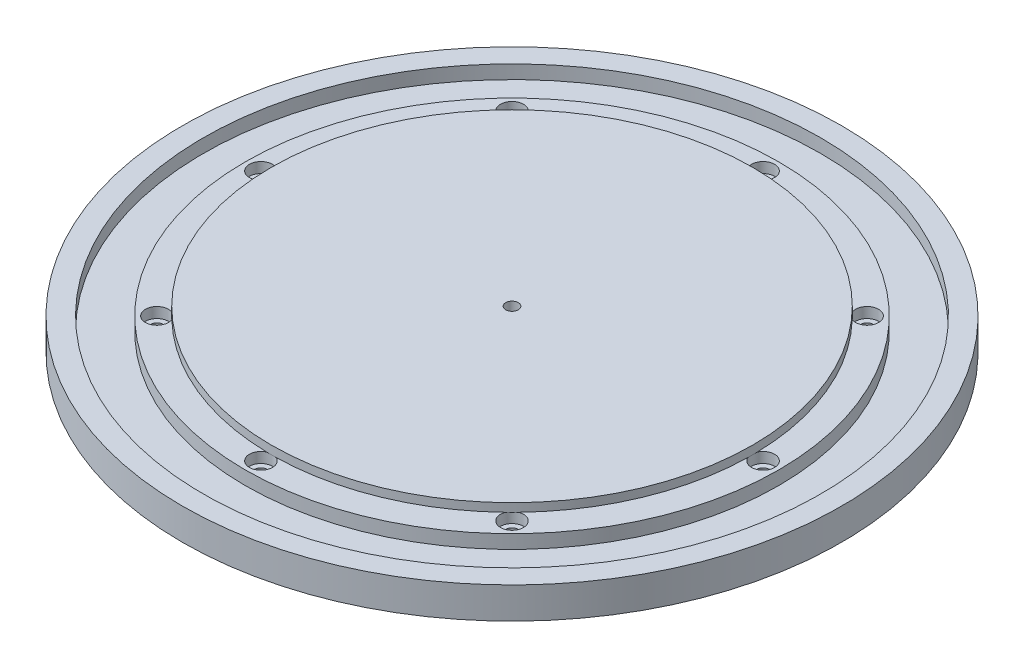
from build123d import *

# Parameters (mm, degrees)
SKETCH2_R               = 11
CUT_EXTRUDE1_DEPTH      = 10
SKETCH3_R               = 6
CUT_EXTRUDE2_DEPTH      = 447.486281987
CUT_EXTRUDE3_DEPTH      = 88
CUT_EXTRUDE3_DEPTH_BACK = 69
SKETCH4_R               = 6


with BuildPart() as part:
    # Sketch1 → Revolve1 (revolve)
    with BuildSketch(Plane(origin=(0, 0, 0), x_dir=(0, 0, -1), z_dir=(1, 0, 0)), mode=Mode.PRIVATE) as revolve1_sk:
        Polygon((-315.000000002, 14.605962764), (-315.000000002, 44.605962764), (-295.000000002, 44.605962764), (-295.000000002, 31.605962764), (-255.000000002, 31.605962764), (-255.000000002, 44.605962764), (-230, 44.605962764), (-230, 52.605962764), (0, 52.605962764), (0, 44.605962764), (0, 14.605962764), (-229.500000002, 14.605962764), align=None)
    revolve(revolve1_sk.sketch.rotate(Axis((0, -1000, 0), (0, 1, 0)), 180), axis=Axis((0, -1000, 0), (0, 1, 0)))

    # Sketch2 → Cut-Extrude1 (cut)
    with BuildSketch(Plane(origin=(0, 44.605962764, 0), x_dir=(1, 0, 0), z_dir=(0, 1, 0))):
        with Locations(Location((0, 240, 0), (0, 0, 270))):
            Circle(SKETCH2_R)
        with Locations(Location((169.705627485, 169.705627485, 0), (0, 0, 270))):
            Circle(SKETCH2_R)
        with Locations(Location((240, 0, 0), (0, 0, 270))):
            Circle(SKETCH2_R)
        with Locations(Location((169.705627485, -169.705627485, 0), (0, 0, 270))):
            Circle(SKETCH2_R)
        with Locations(Location((0, -240, 0), (0, 0, 270))):
            Circle(SKETCH2_R)
        with Locations(Location((-169.705627485, -169.705627485, 0), (0, 0, 270))):
            Circle(SKETCH2_R)
        with Locations(Location((-240, 0, 0), (0, 0, 270))):
            Circle(SKETCH2_R)
        with Locations(Location((-169.705627485, 169.705627485, 0), (0, 0, 270))):
            Circle(SKETCH2_R)
    extrude(amount=-CUT_EXTRUDE1_DEPTH, mode=Mode.SUBTRACT)

    # Sketch3 → Cut-Extrude2 (cut, through all)
    with BuildSketch(Plane(origin=(0, 44.605962764, 0), x_dir=(1, 0, 0), z_dir=(0, 1, 0))):
        with Locations(Location((0, 240, 0), (0, 0, 270))):
            Circle(SKETCH3_R)
        with Locations(Location((169.705627485, 169.705627485, 0), (0, 0, 270))):
            Circle(SKETCH3_R)
        with Locations(Location((240, 0, 0), (0, 0, 270))):
            Circle(SKETCH3_R)
        with Locations(Location((169.705627485, -169.705627485, 0), (0, 0, 270))):
            Circle(SKETCH3_R)
        with Locations(Location((0, -240, 0), (0, 0, 270))):
            Circle(SKETCH3_R)
        with Locations(Location((-169.705627485, -169.705627485, 0), (0, 0, 270))):
            Circle(SKETCH3_R)
        with Locations(Location((-240, 0, 0), (0, 0, 270))):
            Circle(SKETCH3_R)
        with Locations(Location((-169.705627485, 169.705627485, 0), (0, 0, 270))):
            Circle(SKETCH3_R)
    extrude(amount=-CUT_EXTRUDE2_DEPTH, mode=Mode.SUBTRACT)

    # Sketch4 → Cut-Extrude3 (cut, two sides: drawn at the far end of the back side and taken through both)
    with BuildSketch(Plane(origin=(0, 14.605962764, 0), x_dir=(1, 0, 0), z_dir=(0, 1, 0)).offset(-CUT_EXTRUDE3_DEPTH_BACK)):
        with Locations(Location((0, 0, 0), (0, 0, 90))):
            Circle(SKETCH4_R)
    extrude(amount=CUT_EXTRUDE3_DEPTH + CUT_EXTRUDE3_DEPTH_BACK, mode=Mode.SUBTRACT)


solid = part.part
